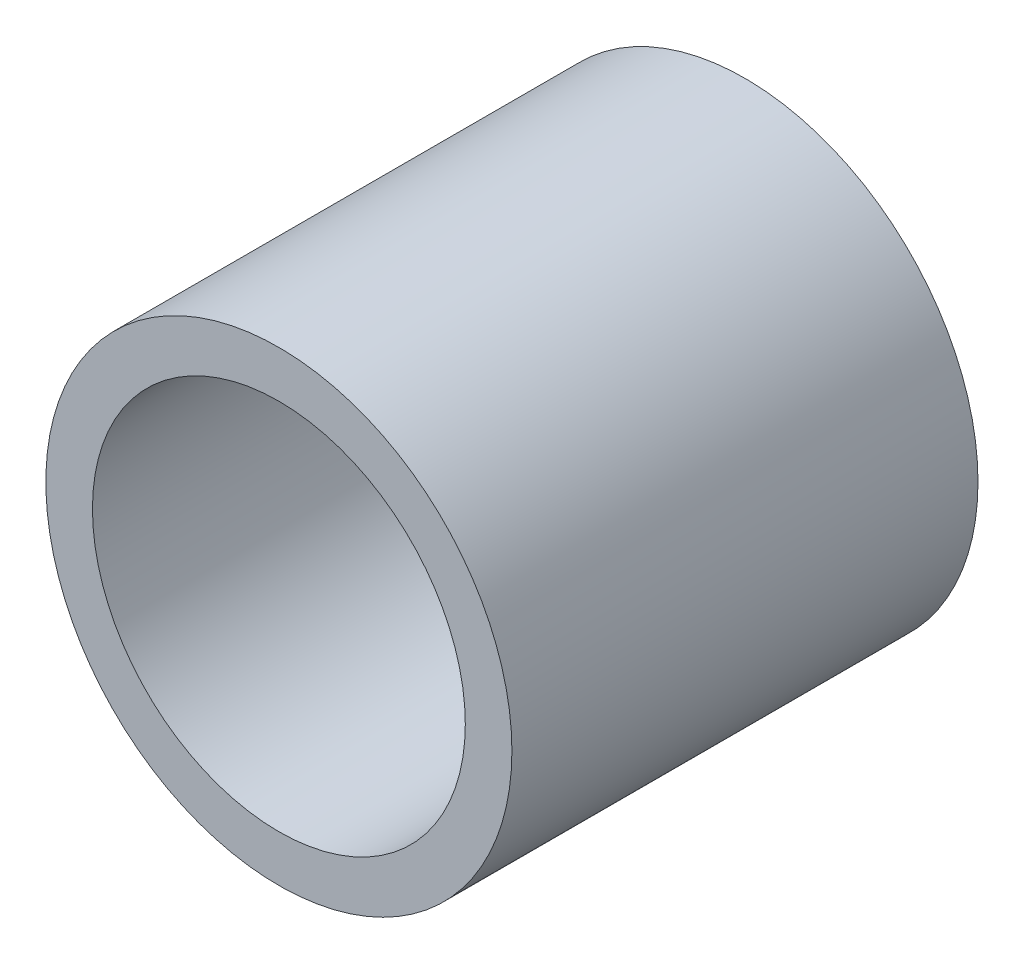
from build123d import *

# Parameters (mm, degrees)
SLEEVE_START  = 8
PROFILE_1_R   = 5
PROFILE_1_R_2 = 4
SLEEVE_DEPTH  = 10


with BuildPart() as part:
    # Profile_1 → Sleeve (new body)
    with BuildSketch(Plane.XY.offset(SLEEVE_START)):
        Circle(PROFILE_1_R)
        Circle(PROFILE_1_R_2, mode=Mode.SUBTRACT)
    extrude(amount=SLEEVE_DEPTH)


solid = part.part
